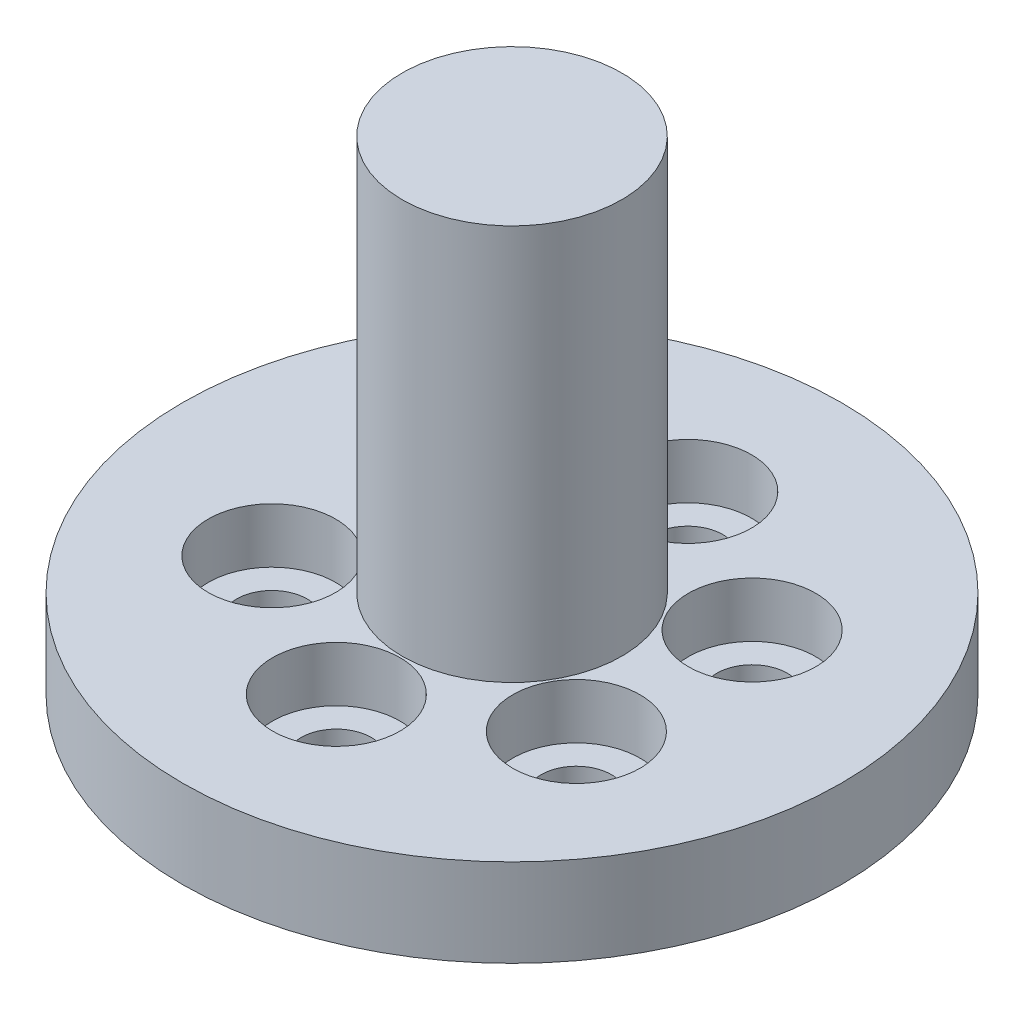
from build123d import *

# Parameters (mm, degrees)
SKETCH_1_R          = 15
EXTRUDE_1_DEPTH     = 4
SKETCH_2_R          = 1.6
CUT_EXTRUDE_1_DEPTH = 5
SKETCH_3_R          = 2.9
CUT_EXTRUDE_2_DEPTH = 2.5
SKETCH_4_R          = 5
EXTRUDE_2_DEPTH     = 18
SKETCH_5_R          = 4
CUT_EXTRUDE_3_DEPTH = 2


with BuildPart() as part:
    # 草图1 → 凸台-拉伸1 (new body)
    with BuildSketch(Plane(origin=(0, 0, 0), x_dir=(1, 0, 0), z_dir=(0, 1, 0))):
        with Locations(Location((0, 0, 0), (0, 0, 270))):
            Circle(SKETCH_1_R)
    extrude(amount=EXTRUDE_1_DEPTH)

    # 草图2 → 切除-拉伸1 (cut)
    with BuildSketch(Plane(origin=(0, 4, 0), x_dir=(1, 0, 0), z_dir=(0, 1, 0))):
        with Locations(Location((0, 8, 0), (0, 0, 270))):
            Circle(SKETCH_2_R)
        with Locations(Location((6.92820323, 4, 0), (0, 0, 270))):
            Circle(SKETCH_2_R)
        with Locations(Location((6.92820323, -4, 0), (0, 0, 270))):
            Circle(SKETCH_2_R)
        with Locations(Location((0, -8, 0), (0, 0, 270))):
            Circle(SKETCH_2_R)
        with Locations(Location((-6.92820323, -4, 0), (0, 0, 270))):
            Circle(SKETCH_2_R)
        with Locations(Location((-6.92820323, 4, 0), (0, 0, 270))):
            Circle(SKETCH_2_R)
    extrude(amount=-CUT_EXTRUDE_1_DEPTH, mode=Mode.SUBTRACT)

    # 草图3 → 切除-拉伸2 (cut)
    with BuildSketch(Plane(origin=(0, 4, 0), x_dir=(1, 0, 0), z_dir=(0, 1, 0))):
        with Locations(Location((0, 8, 0), (0, 0, 270))):
            Circle(SKETCH_3_R)
        with Locations(Location((6.92870323, 4.000866025, 0), (0, 0, 270))):
            Circle(SKETCH_3_R)
        with Locations(Location((6.92970323, -3.999133975, 0), (0, 0, 270))):
            Circle(SKETCH_3_R)
        with Locations(Location((0.002, -8, 0), (0, 0, 270))):
            Circle(SKETCH_3_R)
        with Locations(Location((-6.92670323, -4.000866025, 0), (0, 0, 270))):
            Circle(SKETCH_3_R)
        with Locations(Location((-6.92770323, 3.999133975, 0), (0, 0, 270))):
            Circle(SKETCH_3_R)
    extrude(amount=-CUT_EXTRUDE_2_DEPTH, mode=Mode.SUBTRACT)

    # 草图4 → 凸台-拉伸2 (add)
    with BuildSketch(Plane(origin=(0, 4, 0), x_dir=(1, 0, 0), z_dir=(0, 1, 0))):
        with Locations(Location((0, 0, 0), (0, 0, 270))):
            Circle(SKETCH_4_R)
    extrude(amount=EXTRUDE_2_DEPTH)

    # 草图5 → 切除-拉伸3 (cut)
    with BuildSketch(Plane.XZ):
        with Locations(Location((0, 0, 0), (0, 0, 270))):
            Circle(SKETCH_5_R)
    extrude(amount=-CUT_EXTRUDE_3_DEPTH, mode=Mode.SUBTRACT)


solid = part.part
